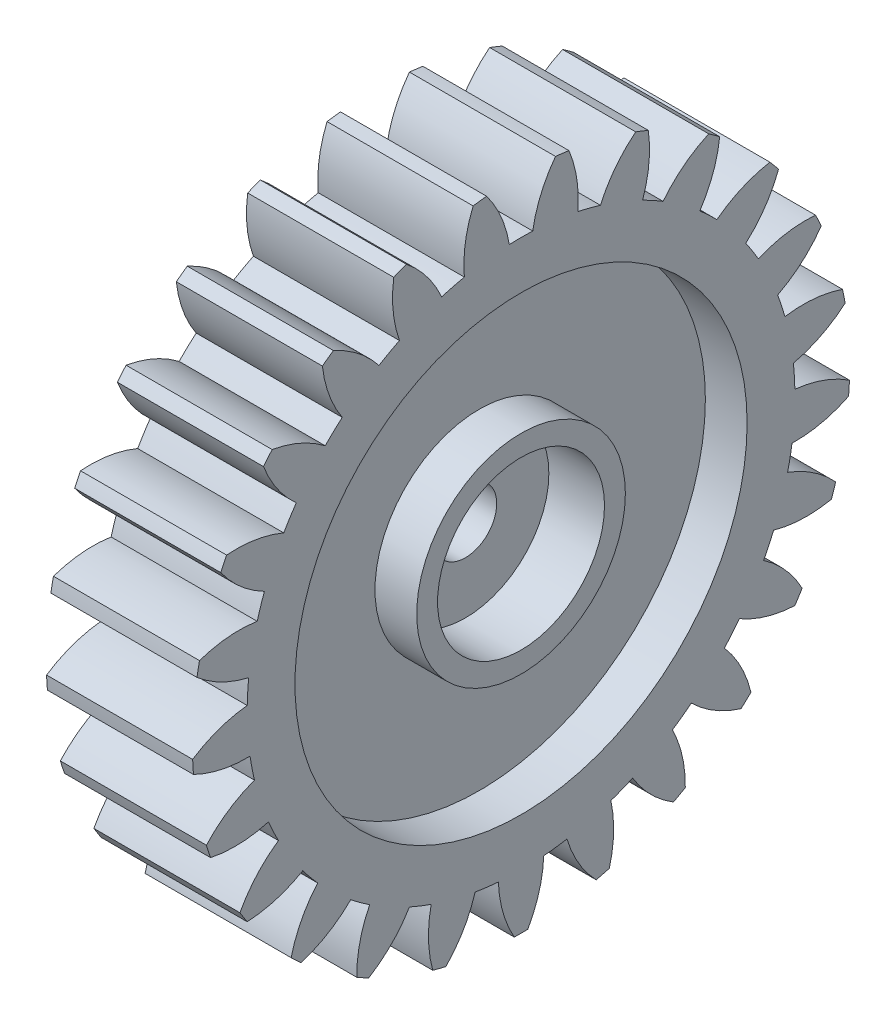
from build123d import *

# Parameters (mm, degrees)
BASPROSKE_W         = 4.2
BASPROSKE_H         = 9.45
TOOTHCUT_DEPTH      = 15.008747267
TEETHCUTS_COUNT     = 25
TEETHCUTS_ANGLE     = 345.6
SKETCH7_R           = 2.4
CUT_EXTRUDE2_DEPTH  = 1.6
SKETCH13_R          = 6.5
SKETCH13_R_2        = 3
CUT_EXTRUDE3_DEPTH  = 1.2
CUT_EXTRUDE4_START  = -1.2
SKETCH15_R          = 6.5
SKETCH15_R_2        = 3
CUT_EXTRUDE4_DEPTH  = 1.2
CUT_EXTRUDE5_START  = -1.6
SKETCH17_R          = 2.4
CUT_EXTRUDE5_DEPTH  = 1.6
SKETCH18_R          = 0.9
CUT_EXTRUDE6_DEPTH  = 1.6
SKETCH19_R          = 3
SKETCH19_R_2        = 2.4
BOSS_EXTRUDE1_DEPTH = 0.6


with BuildPart() as part:
    # BasProSke → Base-Revolve (revolve)
    with BuildSketch(Plane(origin=(0, 0, 0), x_dir=(1, 0, 0), z_dir=(0, 1, 0)), mode=Mode.PRIVATE) as base_revolve_sk:
        with Locations((2.1, 4.725)):
            Rectangle(BASPROSKE_W, BASPROSKE_H)
    revolve(base_revolve_sk.sketch.rotate(Axis((-10, 0, 0), (1, 0, 0)), 180), axis=Axis((-10, 0, 0), (1, 0, 0)))

    # TooCutSke → ToothCut (cut, through all)
    with BuildSketch(Plane(origin=(0, 0, 0), x_dir=(0, 0, -1), z_dir=(1, 0, 0))):
        with BuildLine():
            ThreePointArc((0.336642775, 7.866800343), (0, 7.874), (-0.336642775, 7.866800343))
            ThreePointArc((-0.336642775, 7.866800343), (-0.577188207, 8.685445672), (-1.008672355, 9.421559597))
            ThreePointArc((-1.008672355, 9.421559597), (0, 9.4754), (1.008672355, 9.421559597))
            ThreePointArc((1.008672355, 9.421559597), (0.577188207, 8.685445672), (0.336642775, 7.866800343))
        make_face()
    toothcut = extrude(amount=TOOTHCUT_DEPTH, mode=Mode.SUBTRACT)

    # TeethCuts: ToothCut ×25 about axis
    teethcuts_axis = Axis((-10, 0, 0), (1, 0, 0))
    for i in range(1, TEETHCUTS_COUNT):
        add(toothcut.rotate(teethcuts_axis, i * TEETHCUTS_ANGLE / (TEETHCUTS_COUNT - 1)), mode=Mode.SUBTRACT)

    # Sketch7 → Cut-Extrude2 (cut)
    with BuildSketch(Plane(origin=(4.2, 0, 0), x_dir=(0, 0, -1), z_dir=(1, 0, 0))):
        Circle(SKETCH7_R)
    extrude(amount=-CUT_EXTRUDE2_DEPTH, mode=Mode.SUBTRACT)

    # Sketch13 → Cut-Extrude3 (cut)
    with BuildSketch(Plane(origin=(4.2, 0, 0), x_dir=(0, 0, -1), z_dir=(1, 0, 0))):
        Circle(SKETCH13_R)
        Circle(SKETCH13_R_2, mode=Mode.SUBTRACT)
    extrude(amount=-CUT_EXTRUDE3_DEPTH, mode=Mode.SUBTRACT)

    # Sketch15 → Cut-Extrude4 (cut)
    with BuildSketch(Plane.ZY.offset(CUT_EXTRUDE4_START)):
        with Locations(Location((0, 0, 0), (0, 0, 180))):
            Circle(SKETCH15_R)
        with Locations(Location((0, 0, 0), (0, 0, 180))):
            Circle(SKETCH15_R_2, mode=Mode.SUBTRACT)
    extrude(amount=CUT_EXTRUDE4_DEPTH, mode=Mode.SUBTRACT)

    # Sketch17 → Cut-Extrude5 (cut)
    with BuildSketch(Plane.ZY.offset(CUT_EXTRUDE5_START)):
        with Locations(Location((0, 0, 0), (0, 0, 180))):
            Circle(SKETCH17_R)
    extrude(amount=CUT_EXTRUDE5_DEPTH, mode=Mode.SUBTRACT)

    # Sketch18 → Cut-Extrude6 (cut)
    with BuildSketch(Plane(origin=(2.6, 0, 0), x_dir=(0, 0, -1), z_dir=(1, 0, 0))):
        Circle(SKETCH18_R)
    extrude(amount=-CUT_EXTRUDE6_DEPTH, mode=Mode.SUBTRACT)

    # Sketch19 → Boss-Extrude1 (add)
    with BuildSketch(Plane.ZY):
        with Locations(Location((0, 0, 0), (0, 0, 180))):
            Circle(SKETCH19_R)
        with Locations(Location((0, 0, 0), (0, 0, 180))):
            Circle(SKETCH19_R_2, mode=Mode.SUBTRACT)
    extrude(amount=BOSS_EXTRUDE1_DEPTH)


solid = part.part
